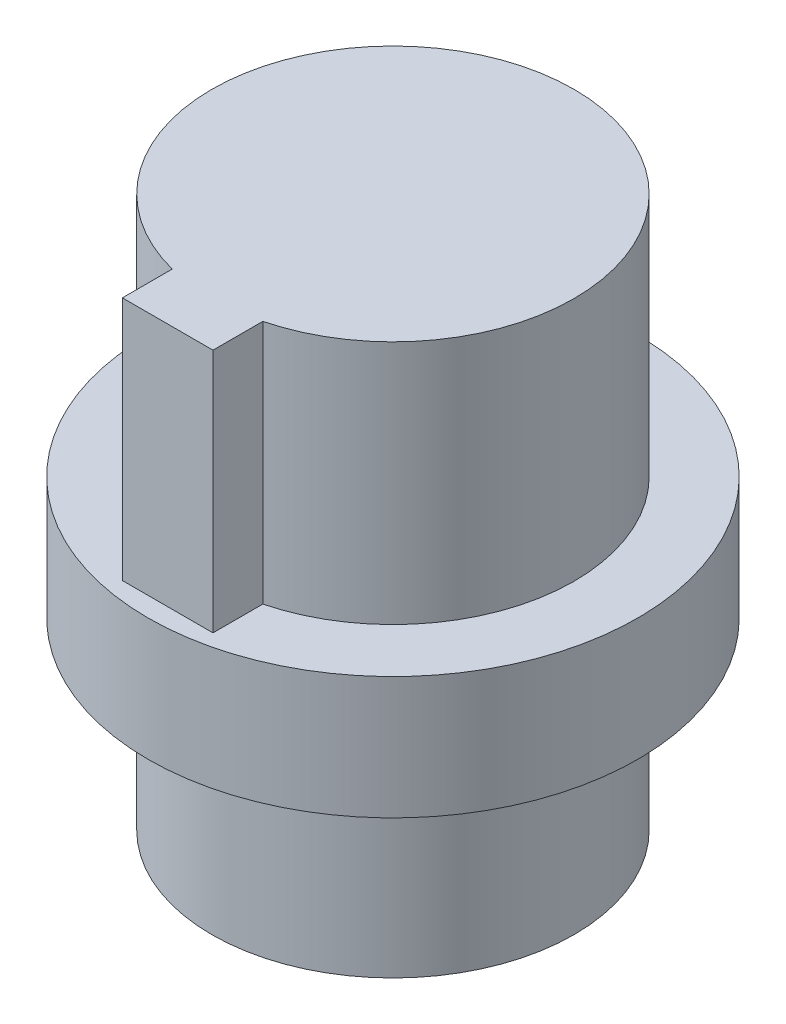
from build123d import *

# Parameters (mm, degrees)
SKETCH1_R                = 9.398
BOSS_EXTRUDE1_DEPTH      = 9.525
SKETCH2_R                = 12.7
BOSS_EXTRUDE2_DEPTH      = 6.35
SKETCH3_R                = 9.398
BOSS_EXTRUDE3_DEPTH      = 12.7
BOSS_EXTRUDE4_REACH      = 41.654
BOSS_EXTRUDE4_END_RADIUS = 9.398
SKETCH4_W                = 4.699
SKETCH4_H                = 12.7


with BuildPart() as part:
    # Sketch1 → Boss-Extrude1 (new body)
    with BuildSketch(Plane(origin=(0, 0, 0), x_dir=(1, 0, 0), z_dir=(0, 1, 0))):
        with Locations(Location((0, 0, 0), (0, 0, 90))):
            Circle(SKETCH1_R)
    extrude(amount=BOSS_EXTRUDE1_DEPTH)

    # Sketch2 → Boss-Extrude2 (add)
    with BuildSketch(Plane(origin=(0, 9.525, 0), x_dir=(1, 0, 0), z_dir=(0, 1, 0))):
        with Locations(Location((0, 0, 0), (0, 0, 270))):
            Circle(SKETCH2_R)
    extrude(amount=BOSS_EXTRUDE2_DEPTH)

    # Sketch3 → Boss-Extrude3 (add)
    with BuildSketch(Plane(origin=(0, 15.875, 0), x_dir=(1, 0, 0), z_dir=(0, 1, 0))):
        with Locations(Location((0, 0, 0), (0, 0, 90))):
            Circle(SKETCH3_R)
    extrude(amount=BOSS_EXTRUDE3_DEPTH)

    # Boss-Extrude4: up to this cylinder (the profile starts outside it)
    boss_extrude4_end = Plane(origin=(0, 22.225, 0), z_dir=(0, -1, 0)) * Cylinder(BOSS_EXTRUDE4_END_RADIUS, 103.104, mode=Mode.PRIVATE)
    # Sketch4 → Boss-Extrude4 (add, up to the surface)
    with BuildSketch(Plane.XY.offset(11.684), mode=Mode.PRIVATE) as boss_extrude4_sk1:
        with Locations((0, 22.225)):
            Rectangle(SKETCH4_W, SKETCH4_H)
    boss_extrude4_tool1 = extrude(boss_extrude4_sk1.sketch, amount=-BOSS_EXTRUDE4_REACH, mode=Mode.PRIVATE) - boss_extrude4_end
    add(boss_extrude4_tool1.solids().sort_by_distance((0, 22.225, 11.684))[0])


solid = part.part
